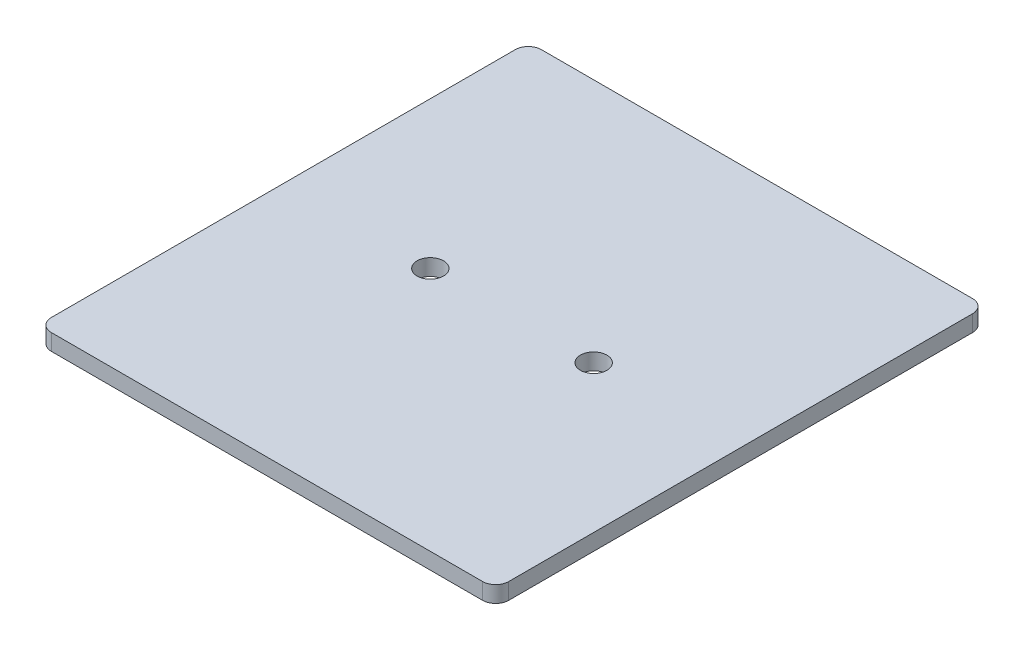
from build123d import *

# Parameters (mm, degrees)
SKETCH1_W           = 140
SKETCH1_H           = 150
BOSS_EXTRUDE1_DEPTH = 5
SKETCH2_R           = 4.05
CUT_EXTRUDE1_DEPTH  = 103.713192921
FILLET1_R           = 4


with BuildPart() as part:
    # Sketch1 → Boss-Extrude1 (new body)
    with BuildSketch(Plane(origin=(0, 0, 0), x_dir=(1, 0, 0), z_dir=(0, 1, 0))):
        Rectangle(SKETCH1_W, SKETCH1_H)
    extrude(amount=BOSS_EXTRUDE1_DEPTH)

    # Sketch2 → Cut-Extrude1 (cut, through all)
    with BuildSketch(Plane(origin=(0, 5, 0), x_dir=(1, 0, 0), z_dir=(0, 1, 0))):
        with Locations(Location((-25, 0, 0), (0, 0, 270))):
            Circle(SKETCH2_R)
    cut_extrude1 = extrude(amount=-CUT_EXTRUDE1_DEPTH, mode=Mode.SUBTRACT)

    # Mirror1: Cut-Extrude1 across plane
    add(cut_extrude1.mirror(Plane(origin=(0, 0, 0), x_dir=(0, 0, 1), z_dir=(1, 0, 0))), mode=Mode.SUBTRACT)

    # Fillet1
    fillet1_edges = [part.edges().sort_by_distance(p)[0] for p in [
        (70, 2.5, 75),
        (-70, 2.5, 75),
        (-70, 2.5, -75),
        (70, 2.5, -75),
    ]]
    fillet(fillet1_edges, radius=FILLET1_R)


solid = part.part
